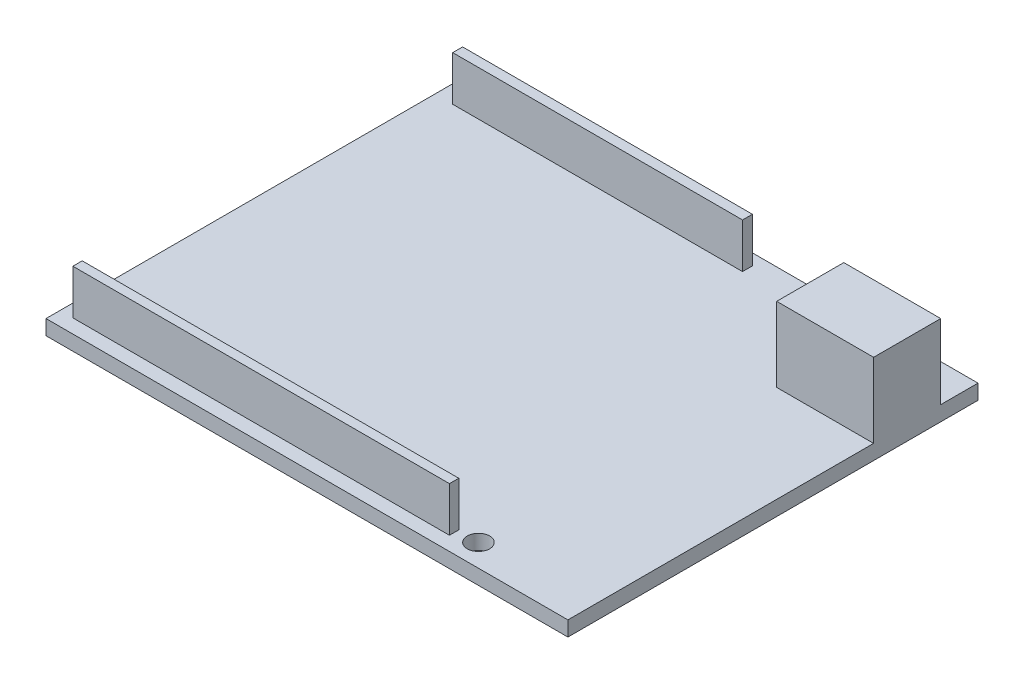
from build123d import *

# Parameters (mm, degrees)
ESQUISSE2_W             = 70
ESQUISSE2_H             = 55
BOSS_EXTRU_1_DEPTH      = 2
ESQUISSE3_W             = 13
ESQUISSE3_H             = 9
BOSS_EXTRU_2_DEPTH      = 10
ESQUISSE4_W             = 38.871257781
ESQUISSE4_H             = 1.325156515
ESQUISSE4_W_2           = 50.503187194
ESQUISSE4_H_2           = 1.251536709
BOSS_EXTRU_3_DEPTH      = 6
ESQUISSE5_R             = 1.5
ENL_V_MAT_EXTRU_1_DEPTH = 6
ESQUISSE6_R             = 1.5
ENL_V_MAT_EXTRU_2_DEPTH = 6


with BuildPart() as part:
    # Esquisse2 → Boss.-Extru.1 (new body)
    with BuildSketch(Plane(origin=(0, 0, 0), x_dir=(1, 0, 0), z_dir=(0, 1, 0))):
        Rectangle(ESQUISSE2_W, ESQUISSE2_H)
    extrude(amount=BOSS_EXTRU_1_DEPTH)

    # Esquisse3 → Boss.-Extru.2 (add)
    with BuildSketch(Plane(origin=(0, 2, 0), x_dir=(1, 0, 0), z_dir=(0, 1, 0))):
        with Locations((28.5, 18)):
            Rectangle(ESQUISSE3_W, ESQUISSE3_H)
    extrude(amount=BOSS_EXTRU_2_DEPTH)

    # Esquisse4 → Boss.-Extru.3 (add)
    with BuildSketch(Plane(origin=(0, 2, 0), x_dir=(1, 0, 0), z_dir=(0, 1, 0))):
        with Locations((-13.177945346, 25.325213404)):
            Rectangle(ESQUISSE4_W, ESQUISSE4_H)
        with Locations((-8.024558898, -24.993924275)):
            Rectangle(ESQUISSE4_W_2, ESQUISSE4_H_2)
    extrude(amount=BOSS_EXTRU_3_DEPTH)

    # Esquisse5 → Enlèv. mat.-Extru.1 (cut)
    with BuildSketch(Plane(origin=(0, 2, 0), x_dir=(1, 0, 0), z_dir=(0, 1, 0))):
        with Locations(Location((20, -24.5, 0), (0, 0, 270))):
            Circle(ESQUISSE5_R)
    extrude(amount=-ENL_V_MAT_EXTRU_1_DEPTH, mode=Mode.SUBTRACT)

    # Esquisse6 → Enlèv. mat.-Extru.2 (cut)
    with BuildSketch(Plane(origin=(0, 2, 0), x_dir=(1, 0, 0), z_dir=(0, 1, 0))):
        with Locations(Location((20.7, 24.5, 0), (0, 0, 270))):
            Circle(ESQUISSE6_R)
    extrude(amount=-ENL_V_MAT_EXTRU_2_DEPTH, mode=Mode.SUBTRACT)


solid = part.part
